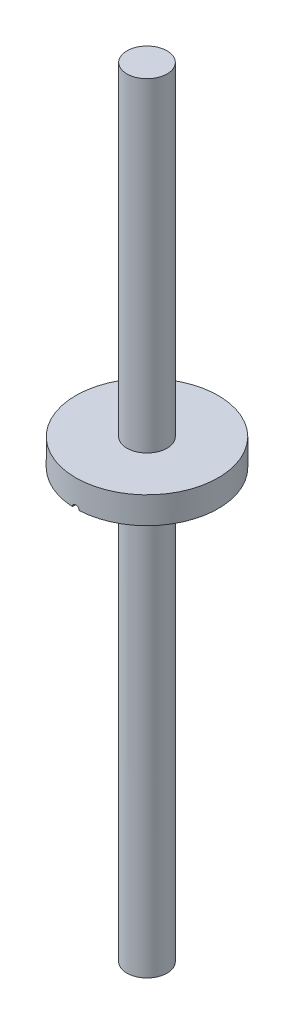
from build123d import *

# Parameters (mm, degrees)
SKETCH1_R                = 16.9291
BOSS_EXTRUDE1_DEPTH      = 6.35
CUT_EXTRUDE1_DEPTH       = 25.769161343
CUT_EXTRUDE1_DEPTH_BACK  = 25.769161343
SKETCH2_R                = 0.809435985
BOSS_EXTRUDE3_DEPTH      = 77
BOSS_EXTRUDE3_DEPTH_BACK = 108
SKETCH3_R                = 4.7625


with BuildPart() as part:
    # Sketch1 → Boss-Extrude1 (new body)
    with BuildSketch(Plane(origin=(0, 0, 0), x_dir=(1, 0, 0), z_dir=(0, 1, 0))):
        with Locations(Location((0, 0, 0), (0, 0, 270))):
            Circle(SKETCH1_R)
    extrude(amount=BOSS_EXTRUDE1_DEPTH)

    # Sketch2 → Cut-Extrude1 (cut, two sides: drawn at the far end of the back side and taken through both)
    with BuildSketch(Plane.XY.offset(-CUT_EXTRUDE1_DEPTH_BACK)):
        Circle(SKETCH2_R)
    extrude(amount=CUT_EXTRUDE1_DEPTH + CUT_EXTRUDE1_DEPTH_BACK, mode=Mode.SUBTRACT)

    # Sketch3 → Boss-Extrude3 (add, two sides: drawn at the far end of the back side and taken through both)
    with BuildSketch(Plane(origin=(0, 6.35, 0), x_dir=(1, 0, 0), z_dir=(0, 1, 0)).offset(-BOSS_EXTRUDE3_DEPTH_BACK)):
        with Locations(Location((0, 0, 0), (0, 0, 270))):
            Circle(SKETCH3_R)
    extrude(amount=BOSS_EXTRUDE3_DEPTH + BOSS_EXTRUDE3_DEPTH_BACK)


solid = part.part
